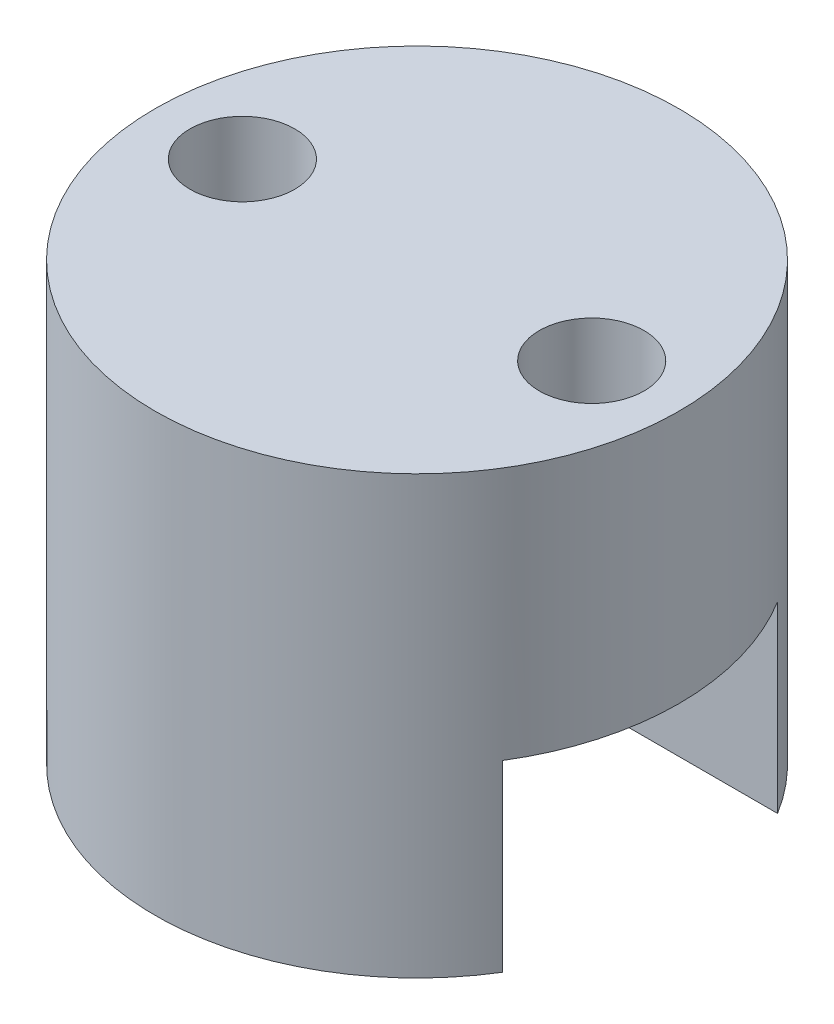
from build123d import *

# Parameters (mm, degrees)
SKETCH_1_R          = 6
EXTRUDE_1_DEPTH     = 10
CUT_EXTRUDE_1_DEPTH = 4.2
SKETCH_3_R          = 1.75
CUT_EXTRUDE_2_DEPTH = 5.5
SKETCH_4_R          = 1.2
CUT_EXTRUDE_3_DEPTH = 5.8


with BuildPart() as part:
    # Эскиз1 → Бобышка-Вытянуть1 (new body)
    with BuildSketch(Plane(origin=(0, 0, 0), x_dir=(1, 0, 0), z_dir=(0, 1, 0))):
        with Locations(Location((0, 0, 0), (0, 0, 270))):
            Circle(SKETCH_1_R)
    extrude(amount=EXTRUDE_1_DEPTH)

    # Эскиз2 → Вырез-Вытянуть1 (cut)
    with BuildSketch(Plane.XZ):
        with BuildLine():
            Line((-5.106613359, 3.15), (5.106613359, 3.15))
            ThreePointArc((5.106613359, 3.15), (6, 0), (5.106613359, -3.15))
            Line((5.106613359, -3.15), (-5.106613359, -3.15))
            ThreePointArc((-5.106613359, -3.15), (-6, 0), (-5.106613359, 3.15))
        make_face()
    extrude(amount=-CUT_EXTRUDE_1_DEPTH, mode=Mode.SUBTRACT)

    # Эскиз3 → Вырез-Вытянуть2 (cut)
    with BuildSketch(Plane.XZ.offset(-4.2)):
        with Locations(Location((0, 0, 0), (0, 0, 270))):
            Circle(SKETCH_3_R)
    extrude(amount=-CUT_EXTRUDE_2_DEPTH, mode=Mode.SUBTRACT)

    # Эскиз4 → Вырез-Вытянуть3 (cut)
    with BuildSketch(Plane.XZ.offset(-4.2)):
        with Locations(Location((-4, 0, 0), (0, 0, 270))):
            Circle(SKETCH_4_R)
        with Locations(Location((4, 0, 0), (0, 0, 90))):
            Circle(SKETCH_4_R)
    extrude(amount=-CUT_EXTRUDE_3_DEPTH, mode=Mode.SUBTRACT)


solid = part.part
